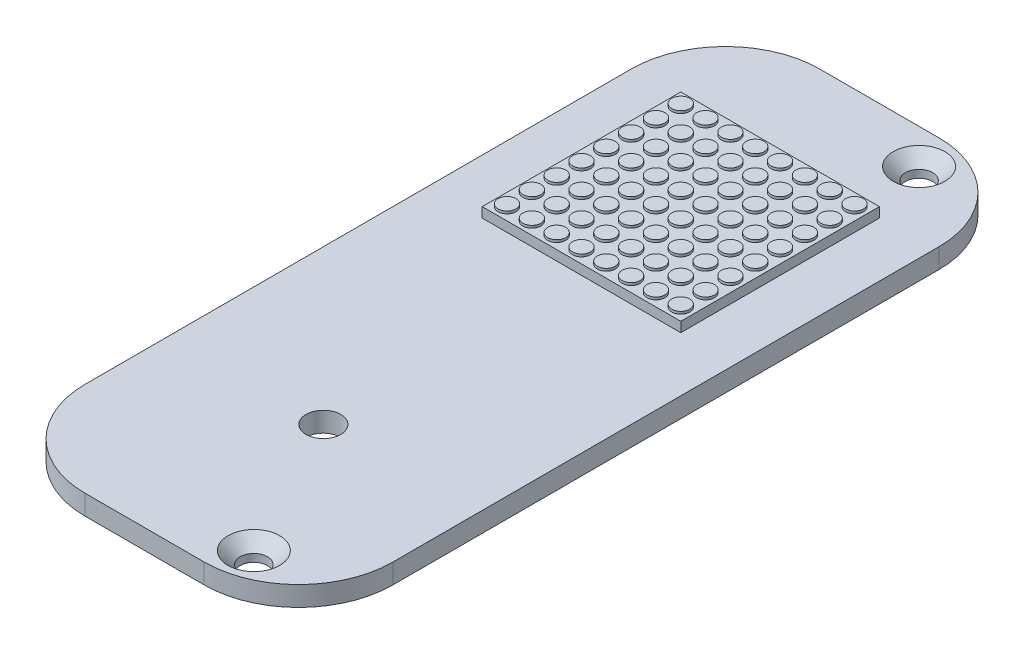
from build123d import *

# Parameters (mm, degrees)
SKETCH1_R                                    = 3.5
SKETCH1_W                                    = 40
SKETCH1_H                                    = 40
BOSS_EXTRUDE1_DEPTH                          = 4
SKETCH1_5_W                                  = 40
SKETCH1_5_H                                  = 40
SKETCH1_5_R                                  = 1.8
BOSS_EXTRUDE2_DEPTH                          = 6
SKETCH1_6_R                                  = 1.8
BOSS_EXTRUDE3_DEPTH                          = 6.5
CSK_FOR_M5_COUNTERSUNK_FLAT_HEAD1_AT_2_COUNT = 2
CSK_FOR_M5_COUNTERSUNK_FLAT_HEAD1_AT_2_PITCH = 134


with BuildPart() as part:
    # Sketch1 → Boss-Extrude1 (new body)
    with BuildSketch(Plane(origin=(0, 0, 0), x_dir=(1, 0, 0), z_dir=(0, 1, 0))):
        with BuildLine():
            Line((-12, -74), (12, -74))
            ThreePointArc((12, -74), (25.435028843, -68.435028843), (31, -55))
            Line((31, -55), (31, 55))
            ThreePointArc((31, 55), (25.435028843, 68.435028843), (12, 74))
            Line((12, 74), (-12, 74))
            ThreePointArc((-12, 74), (-25.435028843, 68.435028843), (-31, 55))
            Line((-31, 55), (-31, -55))
            ThreePointArc((-31, -55), (-25.435028843, -68.435028843), (-12, -74))
        make_face()
        with Locations(Location((0, -38, 0), (0, 0, 270))):
            Circle(SKETCH1_R, mode=Mode.SUBTRACT)
        with Locations((0, 34)):
            Rectangle(SKETCH1_W, SKETCH1_H, mode=Mode.SUBTRACT)
    extrude(amount=BOSS_EXTRUDE1_DEPTH)

    # Sketch1<5> → Boss-Extrude2 (add)
    with BuildSketch(Plane(origin=(0, 0, 0), x_dir=(1, 0, 0), z_dir=(0, 1, 0))):
        with Locations((0, 34)):
            Rectangle(SKETCH1_5_W, SKETCH1_5_H)
        with Locations(Location((-17.5, 51.5, 0), (0, 0, 270))):
            Circle(SKETCH1_5_R, mode=Mode.SUBTRACT)
        with Locations(Location((-17.5, 46.5, 0), (0, 0, 270))):
            Circle(SKETCH1_5_R, mode=Mode.SUBTRACT)
        with Locations(Location((-17.5, 41.5, 0), (0, 0, 270))):
            Circle(SKETCH1_5_R, mode=Mode.SUBTRACT)
        with Locations(Location((-17.5, 36.5, 0), (0, 0, 270))):
            Circle(SKETCH1_5_R, mode=Mode.SUBTRACT)
        with Locations(Location((-17.5, 31.5, 0), (0, 0, 270))):
            Circle(SKETCH1_5_R, mode=Mode.SUBTRACT)
        with Locations(Location((-17.5, 26.5, 0), (0, 0, 270))):
            Circle(SKETCH1_5_R, mode=Mode.SUBTRACT)
        with Locations(Location((-17.5, 21.5, 0), (0, 0, 270))):
            Circle(SKETCH1_5_R, mode=Mode.SUBTRACT)
        with Locations(Location((-17.5, 16.5, 0), (0, 0, 270))):
            Circle(SKETCH1_5_R, mode=Mode.SUBTRACT)
        with Locations(Location((-12.5, 46.5, 0), (0, 0, 270))):
            Circle(SKETCH1_5_R, mode=Mode.SUBTRACT)
        with Locations(Location((-12.5, 41.5, 0), (0, 0, 270))):
            Circle(SKETCH1_5_R, mode=Mode.SUBTRACT)
        with Locations(Location((-12.5, 36.5, 0), (0, 0, 270))):
            Circle(SKETCH1_5_R, mode=Mode.SUBTRACT)
        with Locations(Location((-12.5, 31.5, 0), (0, 0, 270))):
            Circle(SKETCH1_5_R, mode=Mode.SUBTRACT)
        with Locations(Location((-12.5, 26.5, 0), (0, 0, 270))):
            Circle(SKETCH1_5_R, mode=Mode.SUBTRACT)
        with Locations(Location((-12.5, 21.5, 0), (0, 0, 270))):
            Circle(SKETCH1_5_R, mode=Mode.SUBTRACT)
        with Locations(Location((-12.5, 16.5, 0), (0, 0, 270))):
            Circle(SKETCH1_5_R, mode=Mode.SUBTRACT)
        with Locations(Location((-7.5, 46.5, 0), (0, 0, 270))):
            Circle(SKETCH1_5_R, mode=Mode.SUBTRACT)
        with Locations(Location((-7.5, 41.5, 0), (0, 0, 270))):
            Circle(SKETCH1_5_R, mode=Mode.SUBTRACT)
        with Locations(Location((-7.5, 36.5, 0), (0, 0, 270))):
            Circle(SKETCH1_5_R, mode=Mode.SUBTRACT)
        with Locations(Location((-7.5, 31.5, 0), (0, 0, 270))):
            Circle(SKETCH1_5_R, mode=Mode.SUBTRACT)
        with Locations(Location((-7.5, 26.5, 0), (0, 0, 270))):
            Circle(SKETCH1_5_R, mode=Mode.SUBTRACT)
        with Locations(Location((-7.5, 21.5, 0), (0, 0, 270))):
            Circle(SKETCH1_5_R, mode=Mode.SUBTRACT)
        with Locations(Location((-7.5, 16.5, 0), (0, 0, 270))):
            Circle(SKETCH1_5_R, mode=Mode.SUBTRACT)
        with Locations(Location((-2.5, 46.5, 0), (0, 0, 270))):
            Circle(SKETCH1_5_R, mode=Mode.SUBTRACT)
        with Locations(Location((-2.5, 41.5, 0), (0, 0, 270))):
            Circle(SKETCH1_5_R, mode=Mode.SUBTRACT)
        with Locations(Location((-2.5, 36.5, 0), (0, 0, 270))):
            Circle(SKETCH1_5_R, mode=Mode.SUBTRACT)
        with Locations(Location((-2.5, 31.5, 0), (0, 0, 270))):
            Circle(SKETCH1_5_R, mode=Mode.SUBTRACT)
        with Locations(Location((-2.5, 26.5, 0), (0, 0, 270))):
            Circle(SKETCH1_5_R, mode=Mode.SUBTRACT)
        with Locations(Location((-2.5, 21.5, 0), (0, 0, 270))):
            Circle(SKETCH1_5_R, mode=Mode.SUBTRACT)
        with Locations(Location((-2.5, 16.5, 0), (0, 0, 270))):
            Circle(SKETCH1_5_R, mode=Mode.SUBTRACT)
        with Locations(Location((2.5, 46.5, 0), (0, 0, 270))):
            Circle(SKETCH1_5_R, mode=Mode.SUBTRACT)
        with Locations(Location((2.5, 41.5, 0), (0, 0, 270))):
            Circle(SKETCH1_5_R, mode=Mode.SUBTRACT)
        with Locations(Location((2.5, 36.5, 0), (0, 0, 270))):
            Circle(SKETCH1_5_R, mode=Mode.SUBTRACT)
        with Locations(Location((2.5, 31.5, 0), (0, 0, 270))):
            Circle(SKETCH1_5_R, mode=Mode.SUBTRACT)
        with Locations(Location((2.5, 26.5, 0), (0, 0, 270))):
            Circle(SKETCH1_5_R, mode=Mode.SUBTRACT)
        with Locations(Location((2.5, 21.5, 0), (0, 0, 270))):
            Circle(SKETCH1_5_R, mode=Mode.SUBTRACT)
        with Locations(Location((2.5, 16.5, 0), (0, 0, 270))):
            Circle(SKETCH1_5_R, mode=Mode.SUBTRACT)
        with Locations(Location((7.5, 46.5, 0), (0, 0, 270))):
            Circle(SKETCH1_5_R, mode=Mode.SUBTRACT)
        with Locations(Location((7.5, 41.5, 0), (0, 0, 270))):
            Circle(SKETCH1_5_R, mode=Mode.SUBTRACT)
        with Locations(Location((7.5, 36.5, 0), (0, 0, 270))):
            Circle(SKETCH1_5_R, mode=Mode.SUBTRACT)
        with Locations(Location((7.5, 31.5, 0), (0, 0, 270))):
            Circle(SKETCH1_5_R, mode=Mode.SUBTRACT)
        with Locations(Location((7.5, 26.5, 0), (0, 0, 270))):
            Circle(SKETCH1_5_R, mode=Mode.SUBTRACT)
        with Locations(Location((7.5, 21.5, 0), (0, 0, 270))):
            Circle(SKETCH1_5_R, mode=Mode.SUBTRACT)
        with Locations(Location((7.5, 16.5, 0), (0, 0, 270))):
            Circle(SKETCH1_5_R, mode=Mode.SUBTRACT)
        with Locations(Location((12.5, 46.5, 0), (0, 0, 270))):
            Circle(SKETCH1_5_R, mode=Mode.SUBTRACT)
        with Locations(Location((12.5, 41.5, 0), (0, 0, 270))):
            Circle(SKETCH1_5_R, mode=Mode.SUBTRACT)
        with Locations(Location((12.5, 36.5, 0), (0, 0, 270))):
            Circle(SKETCH1_5_R, mode=Mode.SUBTRACT)
        with Locations(Location((12.5, 31.5, 0), (0, 0, 270))):
            Circle(SKETCH1_5_R, mode=Mode.SUBTRACT)
        with Locations(Location((12.5, 26.5, 0), (0, 0, 270))):
            Circle(SKETCH1_5_R, mode=Mode.SUBTRACT)
        with Locations(Location((12.5, 21.5, 0), (0, 0, 270))):
            Circle(SKETCH1_5_R, mode=Mode.SUBTRACT)
        with Locations(Location((12.5, 16.5, 0), (0, 0, 270))):
            Circle(SKETCH1_5_R, mode=Mode.SUBTRACT)
        with Locations(Location((17.5, 46.5, 0), (0, 0, 270))):
            Circle(SKETCH1_5_R, mode=Mode.SUBTRACT)
        with Locations(Location((17.5, 41.5, 0), (0, 0, 270))):
            Circle(SKETCH1_5_R, mode=Mode.SUBTRACT)
        with Locations(Location((17.5, 36.5, 0), (0, 0, 270))):
            Circle(SKETCH1_5_R, mode=Mode.SUBTRACT)
        with Locations(Location((17.5, 31.5, 0), (0, 0, 270))):
            Circle(SKETCH1_5_R, mode=Mode.SUBTRACT)
        with Locations(Location((17.5, 26.5, 0), (0, 0, 270))):
            Circle(SKETCH1_5_R, mode=Mode.SUBTRACT)
        with Locations(Location((17.5, 21.5, 0), (0, 0, 270))):
            Circle(SKETCH1_5_R, mode=Mode.SUBTRACT)
        with Locations(Location((17.5, 16.5, 0), (0, 0, 270))):
            Circle(SKETCH1_5_R, mode=Mode.SUBTRACT)
        with Locations(Location((-12.5, 51.5, 0), (0, 0, 270))):
            Circle(SKETCH1_5_R, mode=Mode.SUBTRACT)
        with Locations(Location((-7.5, 51.5, 0), (0, 0, 270))):
            Circle(SKETCH1_5_R, mode=Mode.SUBTRACT)
        with Locations(Location((-2.5, 51.5, 0), (0, 0, 270))):
            Circle(SKETCH1_5_R, mode=Mode.SUBTRACT)
        with Locations(Location((2.5, 51.5, 0), (0, 0, 270))):
            Circle(SKETCH1_5_R, mode=Mode.SUBTRACT)
        with Locations(Location((7.5, 51.5, 0), (0, 0, 270))):
            Circle(SKETCH1_5_R, mode=Mode.SUBTRACT)
        with Locations(Location((12.5, 51.5, 0), (0, 0, 270))):
            Circle(SKETCH1_5_R, mode=Mode.SUBTRACT)
        with Locations(Location((17.5, 51.5, 0), (0, 0, 270))):
            Circle(SKETCH1_5_R, mode=Mode.SUBTRACT)
    extrude(amount=BOSS_EXTRUDE2_DEPTH)

    # Sketch1<6> → Boss-Extrude3 (add)
    with BuildSketch(Plane(origin=(0, 0, 0), x_dir=(1, 0, 0), z_dir=(0, 1, 0))):
        with Locations(Location((-7.5, 41.5, 0), (0, 0, 90))):
            Circle(SKETCH1_6_R)
        with Locations(Location((-12.5, 41.5, 0), (0, 0, 90))):
            Circle(SKETCH1_6_R)
        with Locations(Location((-12.5, 46.5, 0), (0, 0, 90))):
            Circle(SKETCH1_6_R)
        with Locations(Location((-7.5, 46.5, 0), (0, 0, 90))):
            Circle(SKETCH1_6_R)
        with Locations(Location((-12.5, 51.5, 0), (0, 0, 90))):
            Circle(SKETCH1_6_R)
        with Locations(Location((-17.5, 51.5, 0), (0, 0, 90))):
            Circle(SKETCH1_6_R)
        with Locations(Location((-17.5, 46.5, 0), (0, 0, 90))):
            Circle(SKETCH1_6_R)
        with Locations(Location((-17.5, 41.5, 0), (0, 0, 90))):
            Circle(SKETCH1_6_R)
        with Locations(Location((-17.5, 36.5, 0), (0, 0, 90))):
            Circle(SKETCH1_6_R)
        with Locations(Location((-17.5, 31.5, 0), (0, 0, 90))):
            Circle(SKETCH1_6_R)
        with Locations(Location((-17.5, 26.5, 0), (0, 0, 90))):
            Circle(SKETCH1_6_R)
        with Locations(Location((-17.5, 21.5, 0), (0, 0, 90))):
            Circle(SKETCH1_6_R)
        with Locations(Location((-17.5, 16.5, 0), (0, 0, 90))):
            Circle(SKETCH1_6_R)
        with Locations(Location((-12.5, 16.5, 0), (0, 0, 90))):
            Circle(SKETCH1_6_R)
        with Locations(Location((-12.5, 21.5, 0), (0, 0, 90))):
            Circle(SKETCH1_6_R)
        with Locations(Location((-12.5, 26.5, 0), (0, 0, 90))):
            Circle(SKETCH1_6_R)
        with Locations(Location((-12.5, 31.5, 0), (0, 0, 90))):
            Circle(SKETCH1_6_R)
        with Locations(Location((-12.5, 36.5, 0), (0, 0, 90))):
            Circle(SKETCH1_6_R)
        with Locations(Location((-7.5, 36.5, 0), (0, 0, 90))):
            Circle(SKETCH1_6_R)
        with Locations(Location((-7.5, 31.5, 0), (0, 0, 90))):
            Circle(SKETCH1_6_R)
        with Locations(Location((-7.5, 26.5, 0), (0, 0, 90))):
            Circle(SKETCH1_6_R)
        with Locations(Location((-7.5, 21.5, 0), (0, 0, 90))):
            Circle(SKETCH1_6_R)
        with Locations(Location((-7.5, 16.5, 0), (0, 0, 90))):
            Circle(SKETCH1_6_R)
        with Locations(Location((-2.5, 16.5, 0), (0, 0, 90))):
            Circle(SKETCH1_6_R)
        with Locations(Location((-2.5, 21.5, 0), (0, 0, 90))):
            Circle(SKETCH1_6_R)
        with Locations(Location((-2.5, 31.5, 0), (0, 0, 90))):
            Circle(SKETCH1_6_R)
        with Locations(Location((-2.5, 26.5, 0), (0, 0, 90))):
            Circle(SKETCH1_6_R)
        with Locations(Location((-2.5, 36.5, 0), (0, 0, 90))):
            Circle(SKETCH1_6_R)
        with Locations(Location((-2.5, 41.5, 0), (0, 0, 90))):
            Circle(SKETCH1_6_R)
        with Locations(Location((-2.5, 46.5, 0), (0, 0, 90))):
            Circle(SKETCH1_6_R)
        with Locations(Location((-2.5, 51.5, 0), (0, 0, 90))):
            Circle(SKETCH1_6_R)
        with Locations(Location((-7.5, 51.5, 0), (0, 0, 90))):
            Circle(SKETCH1_6_R)
        with Locations(Location((2.5, 51.5, 0), (0, 0, 90))):
            Circle(SKETCH1_6_R)
        with Locations(Location((2.5, 46.5, 0), (0, 0, 90))):
            Circle(SKETCH1_6_R)
        with Locations(Location((2.5, 41.5, 0), (0, 0, 90))):
            Circle(SKETCH1_6_R)
        with Locations(Location((7.5, 41.5, 0), (0, 0, 90))):
            Circle(SKETCH1_6_R)
        with Locations(Location((7.5, 46.5, 0), (0, 0, 90))):
            Circle(SKETCH1_6_R)
        with Locations(Location((7.5, 51.5, 0), (0, 0, 90))):
            Circle(SKETCH1_6_R)
        with Locations(Location((12.5, 51.5, 0), (0, 0, 90))):
            Circle(SKETCH1_6_R)
        with Locations(Location((12.5, 46.5, 0), (0, 0, 90))):
            Circle(SKETCH1_6_R)
        with Locations(Location((17.5, 46.5, 0), (0, 0, 90))):
            Circle(SKETCH1_6_R)
        with Locations(Location((17.5, 51.5, 0), (0, 0, 90))):
            Circle(SKETCH1_6_R)
        with Locations(Location((17.5, 41.5, 0), (0, 0, 90))):
            Circle(SKETCH1_6_R)
        with Locations(Location((12.5, 41.5, 0), (0, 0, 90))):
            Circle(SKETCH1_6_R)
        with Locations(Location((12.5, 36.5, 0), (0, 0, 90))):
            Circle(SKETCH1_6_R)
        with Locations(Location((7.5, 36.5, 0), (0, 0, 90))):
            Circle(SKETCH1_6_R)
        with Locations(Location((2.5, 36.5, 0), (0, 0, 90))):
            Circle(SKETCH1_6_R)
        with Locations(Location((2.5, 31.5, 0), (0, 0, 90))):
            Circle(SKETCH1_6_R)
        with Locations(Location((7.5, 31.5, 0), (0, 0, 90))):
            Circle(SKETCH1_6_R)
        with Locations(Location((12.5, 31.5, 0), (0, 0, 90))):
            Circle(SKETCH1_6_R)
        with Locations(Location((17.5, 31.5, 0), (0, 0, 90))):
            Circle(SKETCH1_6_R)
        with Locations(Location((17.5, 36.5, 0), (0, 0, 90))):
            Circle(SKETCH1_6_R)
        with Locations(Location((17.5, 26.5, 0), (0, 0, 90))):
            Circle(SKETCH1_6_R)
        with Locations(Location((17.5, 21.5, 0), (0, 0, 90))):
            Circle(SKETCH1_6_R)
        with Locations(Location((17.5, 16.5, 0), (0, 0, 90))):
            Circle(SKETCH1_6_R)
        with Locations(Location((12.5, 16.5, 0), (0, 0, 90))):
            Circle(SKETCH1_6_R)
        with Locations(Location((12.5, 21.5, 0), (0, 0, 90))):
            Circle(SKETCH1_6_R)
        with Locations(Location((12.5, 26.5, 0), (0, 0, 90))):
            Circle(SKETCH1_6_R)
        with Locations(Location((7.5, 26.5, 0), (0, 0, 90))):
            Circle(SKETCH1_6_R)
        with Locations(Location((2.5, 26.5, 0), (0, 0, 90))):
            Circle(SKETCH1_6_R)
        with Locations(Location((2.5, 21.5, 0), (0, 0, 90))):
            Circle(SKETCH1_6_R)
        with Locations(Location((7.5, 21.5, 0), (0, 0, 90))):
            Circle(SKETCH1_6_R)
        with Locations(Location((7.5, 16.5, 0), (0, 0, 90))):
            Circle(SKETCH1_6_R)
        with Locations(Location((2.5, 16.5, 0), (0, 0, 90))):
            Circle(SKETCH1_6_R)
    extrude(amount=BOSS_EXTRUDE3_DEPTH)

    # Sketch7 → CSK for M5 Countersunk Flat Head1 (revolve, cut)
    with BuildSketch(Plane(origin=(15, 4, -67), x_dir=(0, 0, 1), z_dir=(1, 0, 0))):
        Polygon((0, 0), (0, 4), (2.75, 4), (2.75, 2.45), (5.2, 0), align=None)
    csk_for_m5_countersunk_flat_head1 = revolve(axis=Axis((15, 10.35, -67), (0, -1, 0)), mode=Mode.SUBTRACT)

    # CSK for M5 Countersunk Flat Head1 at 2: CSK for M5 Countersunk Flat Head1 ×2
    with Locations(*[(0, 0, i * CSK_FOR_M5_COUNTERSUNK_FLAT_HEAD1_AT_2_PITCH) for i in range(1, CSK_FOR_M5_COUNTERSUNK_FLAT_HEAD1_AT_2_COUNT)]):
        add(csk_for_m5_countersunk_flat_head1, mode=Mode.SUBTRACT)


solid = part.part
